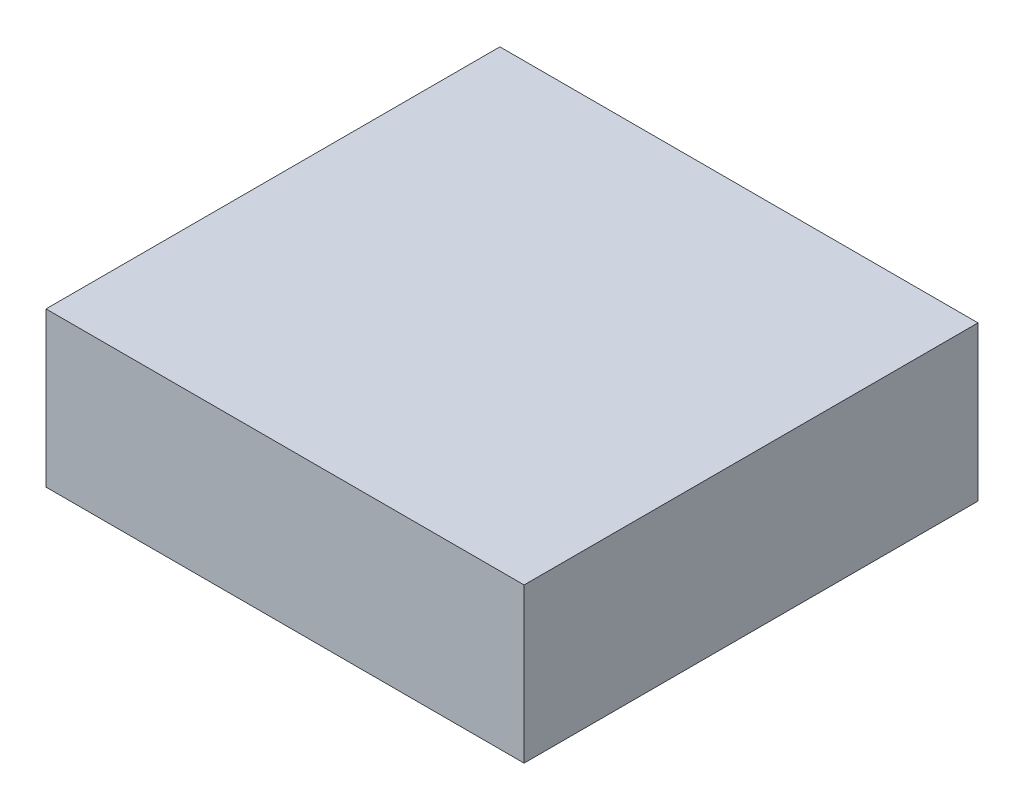
from build123d import *

# Parameters (mm, degrees)
EXTRUDE_1_DEPTH     = 30
SKETCH_1_W          = 100
SKETCH_1_H          = 100
EXTRUDE_1_2_DEPTH   = 30
SKETCH_2_R          = 7.5
CUT_EXTRUDE_1_DEPTH = 10
CUT_EXTRUDE_2_DEPTH = 190.208879284
SKETCH_4_W          = 100
SKETCH_4_H          = 11.779621946
CUT_EXTRUDE_3_DEPTH = 77.811457479
SKETCH_5_W          = 7.075234897
SKETCH_5_H          = 88.220378054
CUT_EXTRUDE_5_DEPTH = 77.811457479


with BuildPart() as part:
    # 草图1 → 凸台-拉伸1 (new body)
    with BuildSketch(Plane(origin=(0, 0, 0), x_dir=(1, 0, 0), z_dir=(0, 1, 0))):
        Polygon((80, -50), (180, -50), (80, 50), align=None)
    extrude(amount=EXTRUDE_1_DEPTH)


with BuildPart() as body_2:
    # 草图1 → Extrude 1 2 (new body)
    with BuildSketch(Plane(origin=(0, 0, 0), x_dir=(1, 0, 0), z_dir=(0, 1, 0))):
        Rectangle(SKETCH_1_W, SKETCH_1_H)
    extrude(amount=EXTRUDE_1_2_DEPTH)

    # 草图2 → 切除-拉伸1 (cut)
    with BuildSketch(Plane.XZ):
        Circle(SKETCH_2_R)
        with BuildLine():
            Line((-24.343668286, -22.5), (25.656331714, -22.5))
            ThreePointArc((25.656331714, -22.5), (33.156331714, -30), (25.656331714, -37.5))
            Line((25.656331714, -37.5), (-24.343668286, -37.5))
            ThreePointArc((-24.343668286, -37.5), (-31.843668286, -30), (-24.343668286, -22.5))
        make_face()
    extrude(amount=-CUT_EXTRUDE_1_DEPTH, mode=Mode.SUBTRACT)

    # 草图4 → 切除-拉伸3 (cut, through all)
    with BuildSketch(Plane.XZ):
        with Locations((0, 44.110189027)):
            Rectangle(SKETCH_4_W, SKETCH_4_H)
    extrude(amount=-CUT_EXTRUDE_3_DEPTH, mode=Mode.SUBTRACT)

    # 草图5 → 切除-拉伸5 (cut, through all)
    with BuildSketch(Plane.XZ):
        with Locations((-46.462382551, -5.889810973)):
            Rectangle(SKETCH_5_W, SKETCH_5_H)
    extrude(amount=-CUT_EXTRUDE_5_DEPTH, mode=Mode.SUBTRACT)


with BuildPart() as body_3:
    # 镜向1: mirrored copy
    add(part.part.mirror(Plane(origin=(0, 0, 0), x_dir=(0, 0, 1), z_dir=(1, 0, 0))))


with BuildPart() as cut_extrude_2_tool:
    # 草图3 → 切除-拉伸2 (new, through all)
    with BuildSketch(Plane.XZ):
        Polygon((80, 50), (80, -50), (180, 50), align=None)
        Polygon((-80, -50), (-80, 50), (-180, 50), align=None)
    extrude(amount=-CUT_EXTRUDE_2_DEPTH)


with BuildPart() as part_1:
    add(part.part)

    # 切除-拉伸2: cut by cut_extrude_2_tool
    add(cut_extrude_2_tool.part, mode=Mode.SUBTRACT)


with BuildPart() as body_3_1:
    add(body_3.part)

    # 切除-拉伸2: cut by cut_extrude_2_tool
    add(cut_extrude_2_tool.part, mode=Mode.SUBTRACT)


solid = body_2.part
